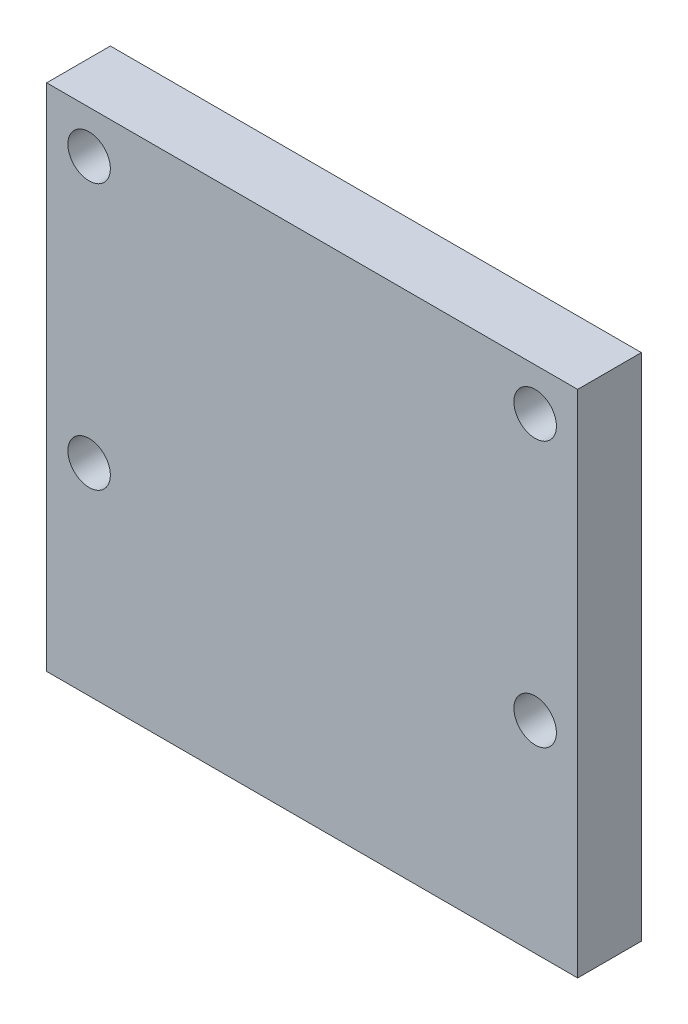
from build123d import *

# Parameters (mm, degrees)
SKETCH_1_W                = 25
SKETCH_1_H                = 24
EXTRUDE_1_DEPTH           = 3
HOLE_WIZARD_2_0_2_1_D     = 2
HOLE_WIZARD_2_0_2_1_DEPTH = 5.5
HOLE_WIZARD_2_0_2_1_TIP   = 0.600860619


with BuildPart() as part:
    # 草图1 → 凸台-拉伸1 (new body)
    with BuildSketch(Plane.XY):
        with Locations((-1.895437834, 0.316156105)):
            Rectangle(SKETCH_1_W, SKETCH_1_H)
    extrude(amount=EXTRUDE_1_DEPTH)

    # Ø2.0 (2) 直径孔1
    with Locations(Plane.XY.offset(3)):
        with Locations((-12.395437834, 10.316156105), (8.604562166, 10.316156105), (-12.395437834, -2.183843895), (8.604562166, -2.183843895)):
            Hole(HOLE_WIZARD_2_0_2_1_D / 2, depth=HOLE_WIZARD_2_0_2_1_DEPTH)
            with Locations((0, 0, -(HOLE_WIZARD_2_0_2_1_DEPTH + HOLE_WIZARD_2_0_2_1_TIP / 2))):  # 118° drill point
                Cone(0, HOLE_WIZARD_2_0_2_1_D / 2, HOLE_WIZARD_2_0_2_1_TIP, mode=Mode.SUBTRACT)


solid = part.part
